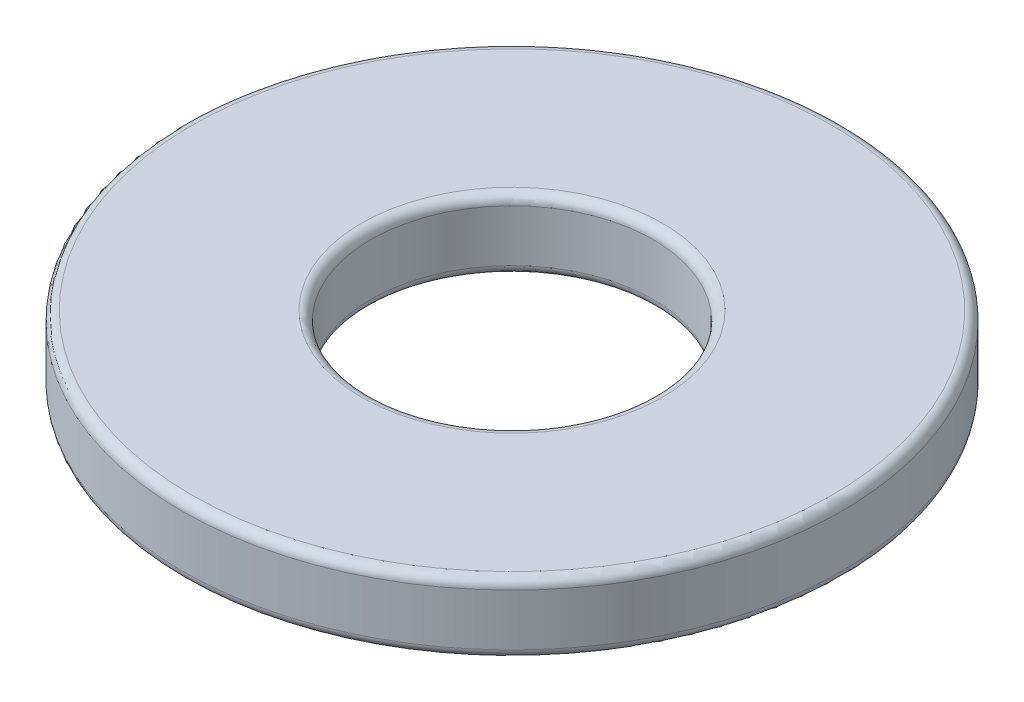
from build123d import *

# Parameters (mm, degrees)
SKETCH1_R           = 3.5
SKETCH1_R_2         = 1.5
BOSS_EXTRUDE1_DEPTH = 0.75
FILLET1_R           = 0.1


with BuildPart() as part:
    # Sketch1 → Boss-Extrude1 (new body)
    with BuildSketch(Plane(origin=(0, 0, 0), x_dir=(1, 0, 0), z_dir=(0, 1, 0))):
        with Locations(Location((0, 0, 0), (0, 0, 270))):
            Circle(SKETCH1_R)
        with Locations(Location((0, 0, 0), (0, 0, 270))):
            Circle(SKETCH1_R_2, mode=Mode.SUBTRACT)
    extrude(amount=BOSS_EXTRUDE1_DEPTH)

    # Fillet1
    fillet1_edges = [part.edges().sort_by_distance(p)[0] for p in [
        (0, 0, -3.5),
        (0, 0.75, -3.5),
        (0, 0, -1.5),
        (0, 0.75, -1.5),
    ]]
    fillet(fillet1_edges, radius=FILLET1_R)


solid = part.part
